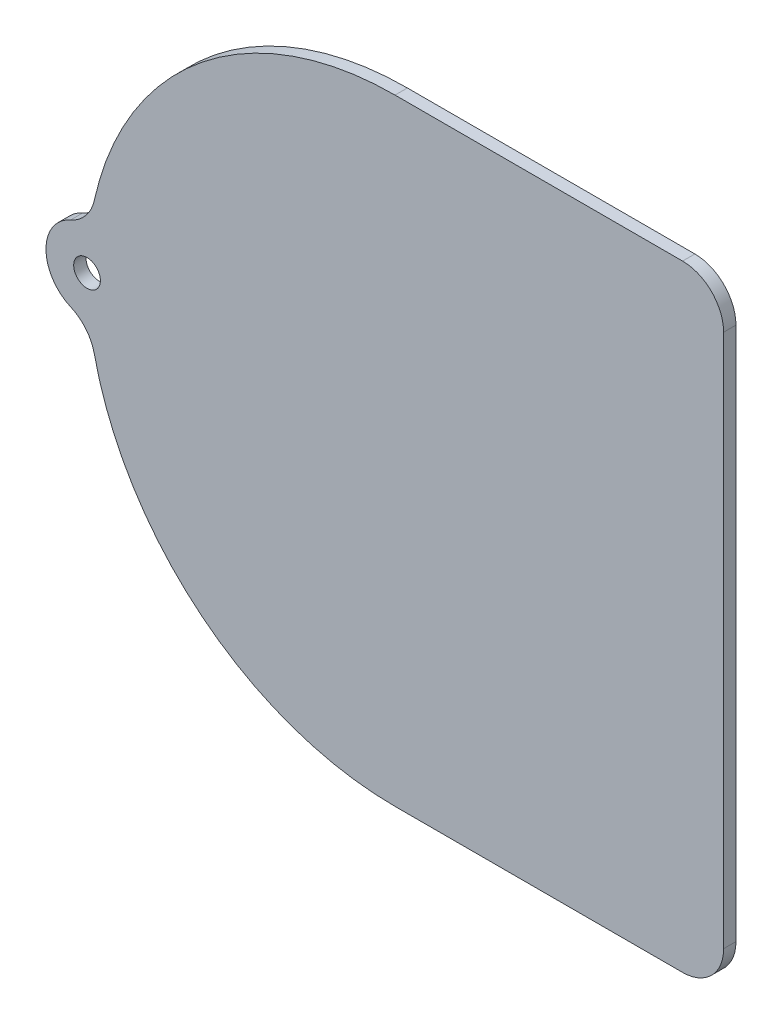
from build123d import *

# Parameters (mm, degrees)
SKETCH1_R        = 3.25
MAIN_PLATE_DEPTH = 3


with BuildPart() as part:
    # Sketch1 → Main Plate (new body)
    with BuildSketch(Plane.XY):
        with BuildLine():
            Line((0, 75), (70, 75))
            ThreePointArc((70, 75), (77.071067812, 72.071067812), (80, 65))
            Line((80, 65), (80, -65))
            ThreePointArc((80, -65), (77.071067812, -72.071067812), (70, -75))
            Line((70, -75), (0, -75))
            ThreePointArc((0, -75), (-46.967889335, -58.472364168), (-73.235294118, -16.17379657))
            ThreePointArc((-73.235294118, -16.17379657), (-75.276849165, -11.977906289), (-79, -9.16515139))
            ThreePointArc((-79, -9.16515139), (-85, 0), (-79, 9.16515139))
            ThreePointArc((-79, 9.16515139), (-75.276849165, 11.977906289), (-73.235294118, 16.17379657))
            ThreePointArc((-73.235294118, 16.17379657), (-46.967889335, 58.472364168), (0, 75))
        make_face()
        with Locations((-75, 0)):
            Circle(SKETCH1_R, mode=Mode.SUBTRACT)
    extrude(amount=MAIN_PLATE_DEPTH)


solid = part.part
